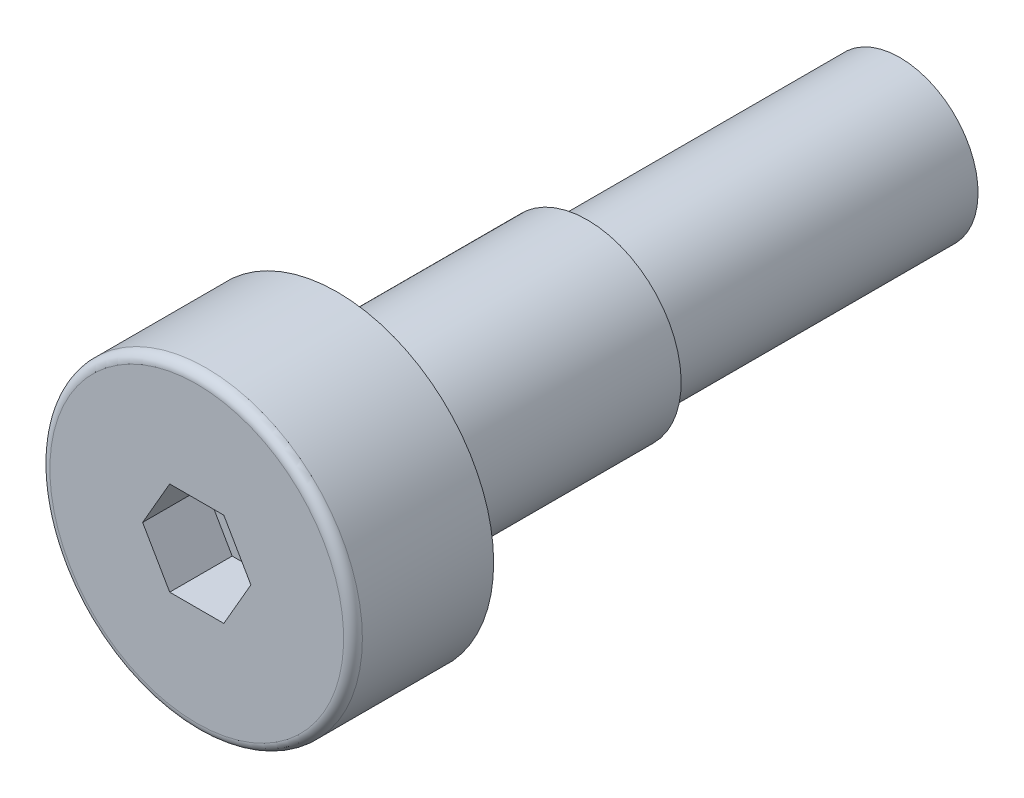
from build123d import *

# Parameters (mm, degrees)
CUT_EXTRUDE_1_DEPTH = 2
FILLET_1_R          = 0.3


with BuildPart() as part:
    # 草图1 → 旋转1 (revolve)
    with BuildSketch(Plane(origin=(0, 0, 0), x_dir=(0, 0, -1), z_dir=(1, 0, 0))):
        Polygon((0, 0), (0, 5), (4.5, 5), (4.5, 3), (12.5, 3), (12.5, 2.5), (22.5, 2.5), (22.5, 0), align=None)
    revolve(axis=Axis((0, 0, -22.5), (0, 0, 1)))

    # 草图2 → 切除-拉伸1 (cut)
    with BuildSketch(Plane.XY):
        Polygon((0.866025404, 1.5), (-0.866025404, 1.5), (-1.732050808, 0), (-0.866025404, -1.5), (0.866025404, -1.5), (1.732050808, 0), align=None)
    extrude(amount=-CUT_EXTRUDE_1_DEPTH, mode=Mode.SUBTRACT)

    # 圆角1
    fillet_1_edges = [part.edges().sort_by_distance(p)[0] for p in [
        (0, -5, 0),
    ]]
    fillet(fillet_1_edges, radius=FILLET_1_R)


solid = part.part
